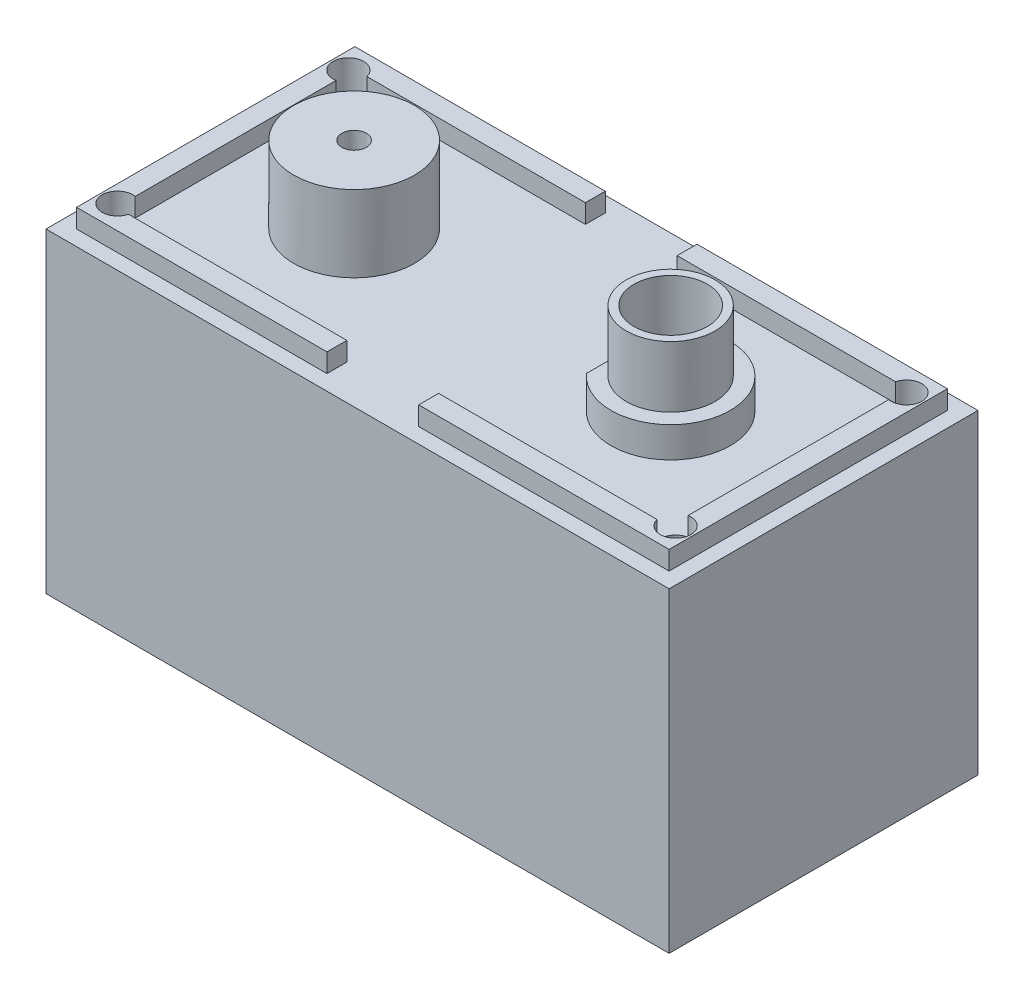
from build123d import *

# Parameters (mm, degrees)
SKETCH_1_W          = 40.75
SKETCH_1_H          = 20.2
EXTRUDE_1_DEPTH     = 20.65
SHELL_1_T           = -1.65
SKETCH_2_W          = 40.75
SKETCH_2_H          = 20.2
EXTRUDE_2_DEPTH     = 1
EXTRUDE_3_DEPTH     = 1.23
SKETCH_4_R          = 3.95
SKETCH_4_R_2        = 0.8
EXTRUDE_4_DEPTH     = 5
EXTRUDE_5_DEPTH     = 2
SKETCH_6_R          = 2.9
SKETCH_6_R_2        = 2.4
EXTRUDE_6_DEPTH     = 4
SKETCH_7_W          = 38.95
SKETCH_7_H          = 18.4
CUT_EXTRUDE_2_DEPTH = 2.6
SKETCH_9_R          = 1.4
EXTRUDE_7_DEPTH     = 17.05
CUT_EXTRUDE_START   = -19.28
SKETCH_8_R          = 1
CUT_EXTRUDE_3_DEPTH = 19.28


with BuildPart() as part:
    # Эскиз1 → Бобышка-Вытянуть1 (new body)
    with BuildSketch(Plane(origin=(0, 0, 0), x_dir=(1, 0, 0), z_dir=(0, 1, 0))):
        Rectangle(SKETCH_1_W, SKETCH_1_H)
    extrude(amount=EXTRUDE_1_DEPTH)

    # Оболочка1
    shell_1_openings = [part.faces().sort_by_distance(p)[0] for p in [
        (0, 20.65, 0),
        (0, 0, 0),
    ]]
    offset(amount=SHELL_1_T, openings=shell_1_openings, kind=Kind.INTERSECTION)

    # Эскиз2 → Бобышка-Вытянуть2 (add)
    with BuildSketch(Plane(origin=(0, 20.65, 0), x_dir=(1, 0, 0), z_dir=(0, 1, 0))):
        Rectangle(SKETCH_2_W, SKETCH_2_H)
    extrude(amount=-EXTRUDE_2_DEPTH)

    # Эскиз3 → Бобышка-Вытянуть3 (add)
    with BuildSketch(Plane(origin=(0, 20.65, 0), x_dir=(1, 0, 0), z_dir=(0, 1, 0))):
        Polygon((-19.375, -9.1), (-3, -9.1), (-3, -7.8), (-18.075, -7.8), (-18.075, 7.8), (-3, 7.8), (-3, 9.1), (-19.375, 9.1), align=None)
        Polygon((19.375, -9.1), (19.375, 9.1), (3, 9.1), (3, 7.8), (18.075, 7.8), (18.075, -7.8), (3, -7.8), (3, -9.1), align=None)
    extrude(amount=EXTRUDE_3_DEPTH)

    # Эскиз4 → Бобышка-Вытянуть4 (add)
    with BuildSketch(Plane(origin=(0, 20.65, 0), x_dir=(1, 0, 0), z_dir=(0, 1, 0))):
        with Locations(Location((-10.325, 0, 0), (0, 0, 90))):
            Circle(SKETCH_4_R)
        with Locations(Location((-10.325, 0, 0), (0, 0, 270))):
            Circle(SKETCH_4_R_2, mode=Mode.SUBTRACT)
    extrude(amount=EXTRUDE_4_DEPTH)

    # Эскиз5 → Бобышка-Вытянуть5 (add)
    with BuildSketch(Plane(origin=(0, 20.65, 0), x_dir=(1, 0, 0), z_dir=(0, 1, 0))):
        with BuildLine():
            Line((7.475, 2.607680962), (7.475, -2.607680962))
            ThreePointArc((7.475, -2.607680962), (14.275, 0), (7.475, 2.607680962))
        make_face()
    extrude(amount=EXTRUDE_5_DEPTH)

    # Эскиз6 → Бобышка-Вытянуть6 (add)
    with BuildSketch(Plane(origin=(0, 22.65, 0), x_dir=(1, 0, 0), z_dir=(0, 1, 0))):
        with Locations(Location((10.375, 0, 0), (0, 0, 180))):
            Circle(SKETCH_6_R)
        with Locations(Location((10.375, 0, 0), (0, 0, 270))):
            Circle(SKETCH_6_R_2, mode=Mode.SUBTRACT)
    extrude(amount=EXTRUDE_6_DEPTH)

    # Эскиз7 → Вырез-Вытянуть2 (cut)
    with BuildSketch(Plane.XZ):
        Rectangle(SKETCH_7_W, SKETCH_7_H)
    extrude(amount=-CUT_EXTRUDE_2_DEPTH, mode=Mode.SUBTRACT)

    # Эскиз9 → Бобышка-Вытянуть7 (add)
    with BuildSketch(Plane.XZ.offset(-19.65)):
        with Locations((-18.25, 7.55)):
            Circle(SKETCH_9_R)
        with Locations((-18.25, -7.55)):
            Circle(SKETCH_9_R)
        with Locations((18.25, -7.55)):
            Circle(SKETCH_9_R)
        with Locations((18.25, 7.55)):
            Circle(SKETCH_9_R)
    extrude(amount=EXTRUDE_7_DEPTH)

    # Эскиз8 → Вырез-Вытянуть3 (cut)
    with BuildSketch(Plane(origin=(0, 21.88, 0), x_dir=(1, 0, 0), z_dir=(0, 1, 0)).offset(CUT_EXTRUDE_START)):
        with Locations(Location((-18.25, 7.55, 0), (0, 0, 270))):
            Circle(SKETCH_8_R)
        with Locations(Location((18.25, 7.55, 0), (0, 0, 270))):
            Circle(SKETCH_8_R)
        with Locations(Location((18.25, -7.55, 0), (0, 0, 270))):
            Circle(SKETCH_8_R)
        with Locations(Location((-18.25, -7.55, 0), (0, 0, 270))):
            Circle(SKETCH_8_R)
    extrude(amount=CUT_EXTRUDE_3_DEPTH, mode=Mode.SUBTRACT)


solid = part.part
